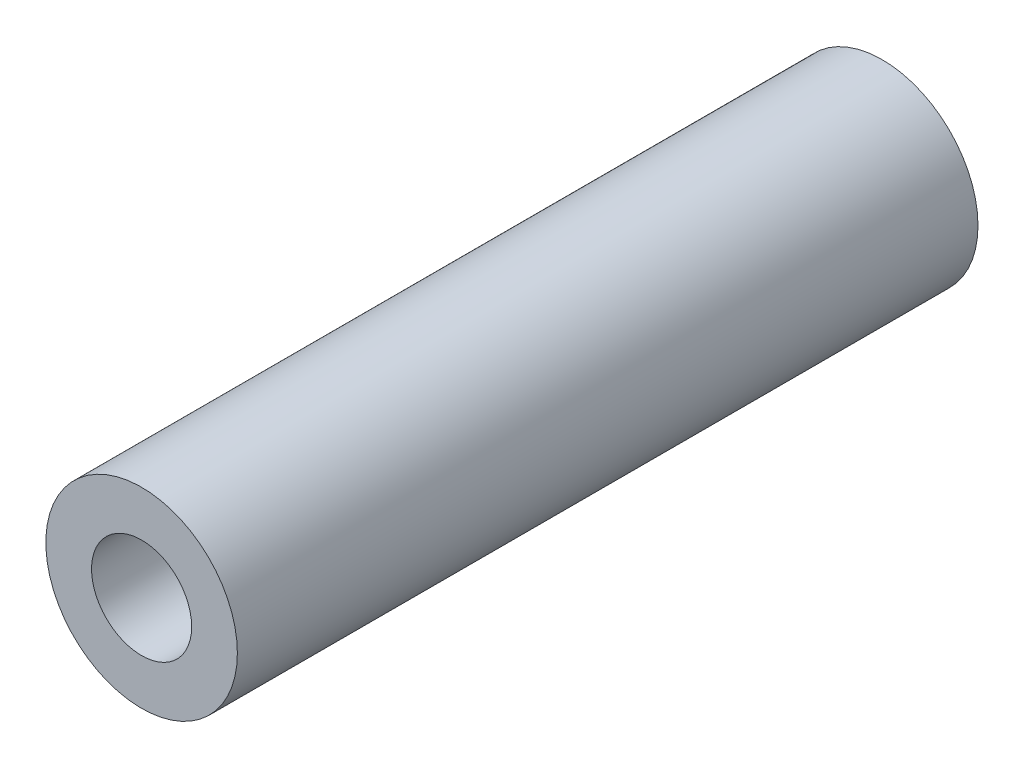
from build123d import *

# Parameters (mm, degrees)
SKETCH1_R           = 4.7625
SKETCH1_R_2         = 2.4892
BOSS_EXTRUDE1_DEPTH = 18.415


with BuildPart() as part:
    # Sketch1 → Boss-Extrude1 (new, symmetric)
    with BuildSketch(Plane.XY):
        Circle(SKETCH1_R)
        Circle(SKETCH1_R_2, mode=Mode.SUBTRACT)
    extrude(amount=BOSS_EXTRUDE1_DEPTH, both=True)


solid = part.part
